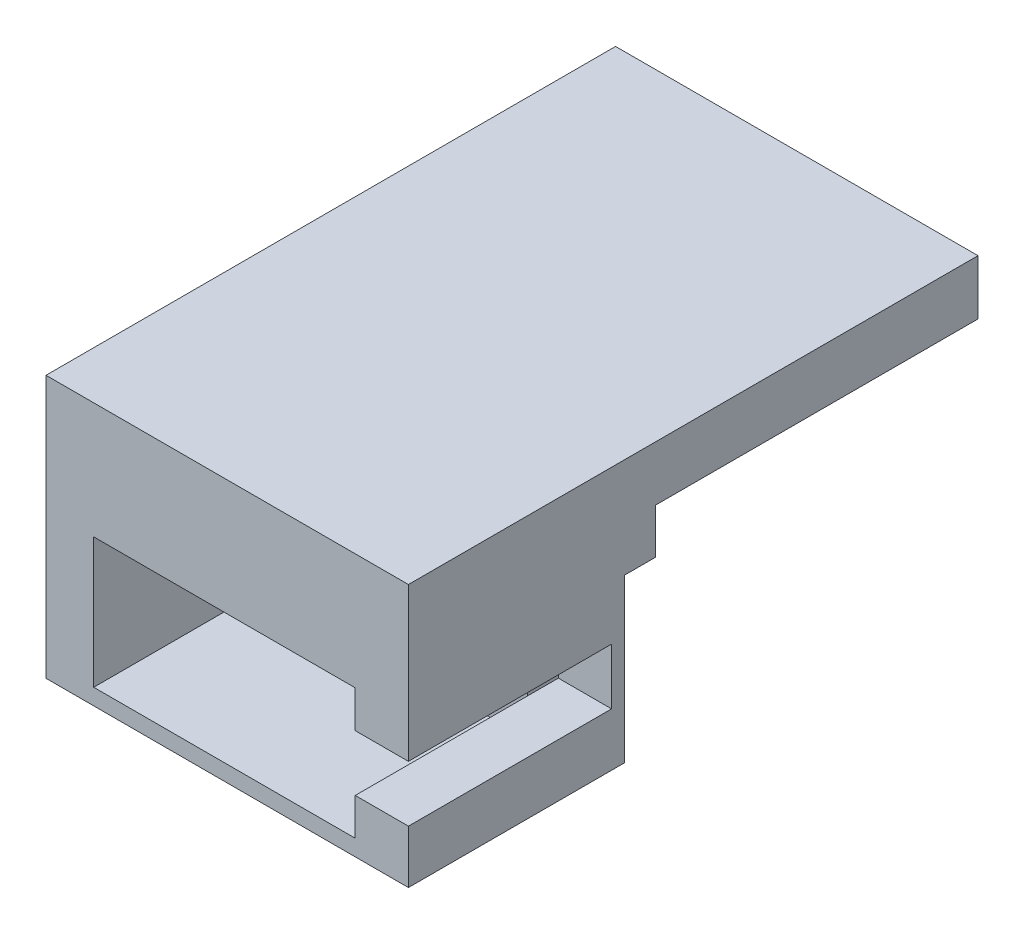
from build123d import *

# Parameters (mm, degrees)
BOSS_EXTRUDE1_DEPTH = 31.5
CUT_EXTRUDE1_DEPTH  = 26.7
SKETCH3_W           = 56.2
SKETCH3_H           = 25.2
BOSS_EXTRUDE2_DEPTH = 2
SKETCH5_W           = 56.2
SKETCH5_H           = 20
BOSS_EXTRUDE4_DEPTH = 7
SKETCH6_W           = 56.2
SKETCH6_H           = 60
BOSS_EXTRUDE5_DEPTH = 8.5
CUT_EXTRUDE2_DEPTH  = 5.5
SKETCH11_R          = 2.32571443
CUT_EXTRUDE3_DEPTH  = 0.5
SKETCH12_W          = 56.2
SKETCH12_H          = 7
BOSS_EXTRUDE8_DEPTH = 18.321145389
SKETCH18_W          = 56.2
SKETCH18_H          = 8.5
BOSS_EXTRUDE9_DEPTH = 28.321145389
FILLET5_R           = 5


with BuildPart() as part:
    # Sketch1 → Boss-Extrude1 (new body)
    with BuildSketch(Plane.XY):
        Polygon((-3.384140796, -1.386438558), (-3.384140796, 23.813561442), (52.815859204, 23.813561442), (52.815859204, 15.563561442), (44.565859204, 15.563561442), (44.565859204, 6.863561442), (52.815859204, 6.863561442), (52.815859204, -1.386438558), align=None)
    extrude(amount=BOSS_EXTRUDE1_DEPTH)

    # Sketch2 → Cut-Extrude1 (cut)
    with BuildSketch(Plane.XY.offset(31.5)):
        Polygon((4.015859204, 21.313561442), (44.565859204, 21.313561442), (44.565859204, 15.563561442), (44.565859204, 6.863561442), (44.565859204, 1.113561442), (4.015859204, 1.113561442), align=None)
    extrude(amount=-CUT_EXTRUDE1_DEPTH, mode=Mode.SUBTRACT)

    # Sketch3 → Boss-Extrude2 (add)
    with BuildSketch(Plane(origin=(0, 0, 0), x_dir=(-1, 0, 0), z_dir=(0, 0, -1))):
        with Locations((-24.715859204, 11.213561442)):
            Rectangle(SKETCH3_W, SKETCH3_H)
    extrude(amount=BOSS_EXTRUDE2_DEPTH)

    # Sketch5 → Boss-Extrude4 (add)
    with BuildSketch(Plane(origin=(0, 23.813561442, 0), x_dir=(1, 0, 0), z_dir=(0, 1, 0))):
        with Locations((24.715859204, -3.178854611)):
            Rectangle(SKETCH5_W, SKETCH5_H)
    extrude(amount=BOSS_EXTRUDE4_DEPTH)

    # Sketch6 → Boss-Extrude5 (add)
    with BuildSketch(Plane(origin=(0, 30.813561442, 0), x_dir=(1, 0, 0), z_dir=(0, 1, 0))):
        with Locations((24.715859204, 26.821145389)):
            Rectangle(SKETCH6_W, SKETCH6_H)
    extrude(amount=BOSS_EXTRUDE5_DEPTH)

    # Sketch10 → Cut-Extrude2 (cut)
    with BuildSketch(Plane.XZ.offset(-30.813561442)):
        with BuildLine():
            Line((28.922300324, -40.947940044), (45.722300324, -40.947940044))
            ThreePointArc((45.722300324, -40.947940044), (49.522300324, -44.747940044), (45.722300324, -48.547940044))
            Line((45.722300324, -48.547940044), (28.922300324, -48.547940044))
            ThreePointArc((28.922300324, -48.547940044), (14.740507255, -44.747940044), (28.922300324, -40.947940044))
        make_face()
    extrude(amount=-CUT_EXTRUDE2_DEPTH, mode=Mode.SUBTRACT)

    # Sketch11 → Cut-Extrude3 (cut)
    with BuildSketch(Plane.XZ.offset(-36.313561442)):
        with Locations(Location((22.340507255, -44.747940044, 0), (0, 0, 270))):
            Circle(SKETCH11_R)
    extrude(amount=-CUT_EXTRUDE3_DEPTH, mode=Mode.SUBTRACT)

    # Sketch12 → Boss-Extrude8 (add)
    with BuildSketch(Plane.XY.offset(13.178854611)):
        with Locations((24.715859204, 27.313561442)):
            Rectangle(SKETCH12_W, SKETCH12_H)
    extrude(amount=BOSS_EXTRUDE8_DEPTH)

    # Sketch18 → Boss-Extrude9 (add)
    with BuildSketch(Plane.XY.offset(3.178854611)):
        with Locations((24.715859204, 35.063561442)):
            Rectangle(SKETCH18_W, SKETCH18_H)
    extrude(amount=BOSS_EXTRUDE9_DEPTH)

    # Fillet5
    fillet5_edges = [part.edges().sort_by_distance(p)[0] for p in [
        (28.922300324, 33.563561442, -48.547940044),
        (28.922300324, 33.563561442, -40.947940044),
    ]]
    fillet(fillet5_edges, radius=FILLET5_R)


solid = part.part
